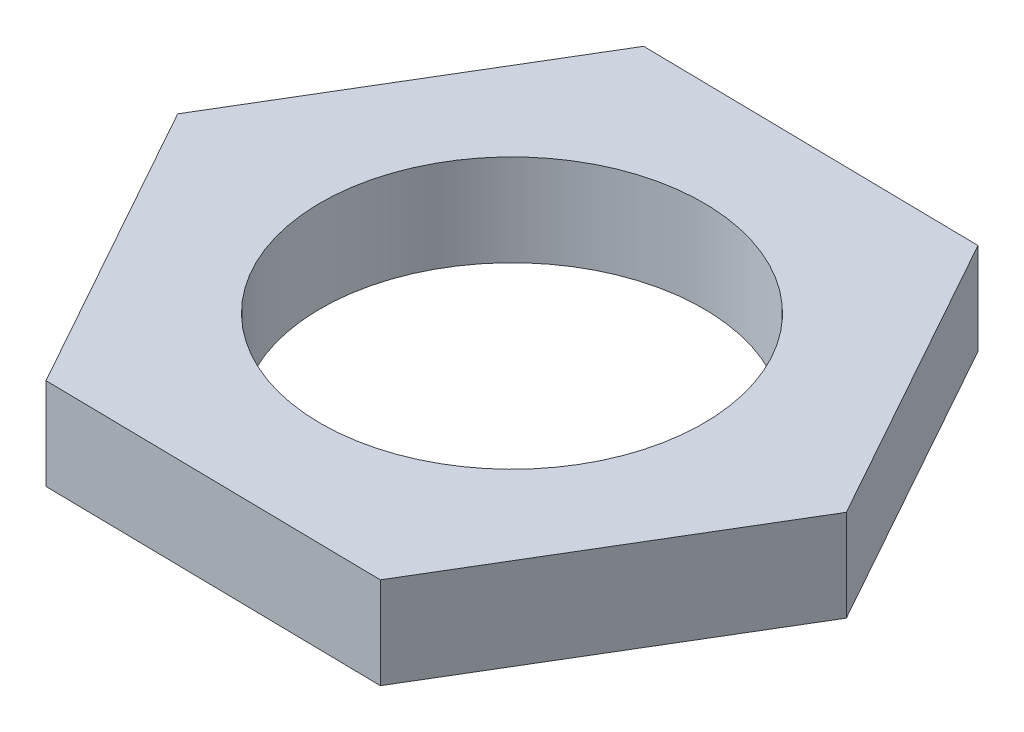
from build123d import *

# Parameters (mm, degrees)
SKETCH1_R           = 4.8
BOSS_EXTRUDE1_DEPTH = 2.3


with BuildPart() as part:
    # Sketch1 → Boss-Extrude1 (new body)
    with BuildSketch(Plane(origin=(0, 0, 0), x_dir=(1, 0, 0), z_dir=(0, 1, 0))):
        Polygon((-4.378352848, -7.313839416), (4.14479431, -7.448684501), (8.523147158, -0.134845085), (4.378352848, 7.313839416), (-4.14479431, 7.448684501), (-8.523147158, 0.134845085), align=None)
        with Locations(Location((0, 0, 0), (0, 0, 270))):
            Circle(SKETCH1_R, mode=Mode.SUBTRACT)
    extrude(amount=BOSS_EXTRUDE1_DEPTH)


solid = part.part
